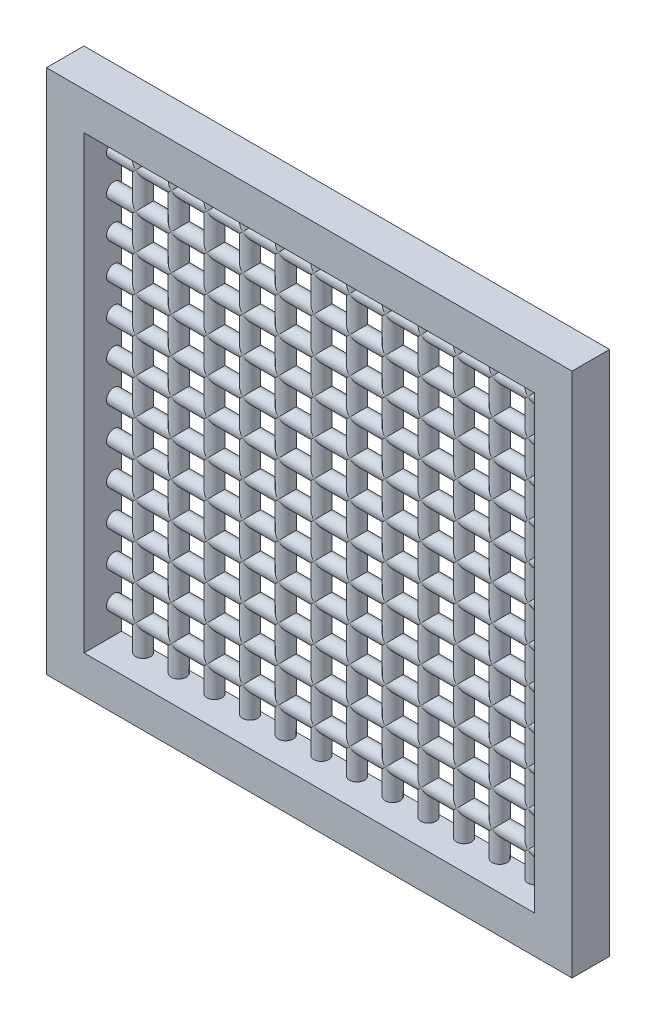
from build123d import *

# Parameters (mm, degrees)
SKETCH1_W                    = 355.6
SKETCH1_H                    = 355.6
SKETCH1_W_2                  = 304.8
SKETCH1_H_2                  = 304.8
BOSS_EXTRUDE1_DEPTH          = 25.4
SKETCH4_R                    = 5.08
LPATTERN1_COUNT              = 12
LPATTERN1_PITCH              = 24.13
CIRPATTERN1_COUNT            = 2
CIRPATTERN1_ANGLE            = 90
CIRPATTERN1_COPY_1_SKETCH_R  = 5.08
CIRPATTERN1_COPY_2_SKETCH_R  = 5.08
CIRPATTERN1_COPY_3_SKETCH_R  = 5.08
CIRPATTERN1_COPY_4_SKETCH_R  = 5.08
CIRPATTERN1_COPY_5_SKETCH_R  = 5.08
CIRPATTERN1_COPY_6_SKETCH_R  = 5.08
CIRPATTERN1_COPY_7_SKETCH_R  = 5.08
CIRPATTERN1_COPY_8_SKETCH_R  = 5.08
CIRPATTERN1_COPY_9_SKETCH_R  = 5.08
CIRPATTERN1_COPY_10_SKETCH_R = 5.08
CIRPATTERN1_COPY_11_SKETCH_R = 5.08


with BuildPart() as part:
    # Sketch1 → Boss-Extrude1 (new body)
    with BuildSketch(Plane.XY):
        Rectangle(SKETCH1_W, SKETCH1_H)
        Rectangle(SKETCH1_W_2, SKETCH1_H_2, mode=Mode.SUBTRACT)
    extrude(amount=BOSS_EXTRUDE1_DEPTH)

    # Sweep1: sweep along a path in Sketch3
    with BuildLine(Plane(origin=(0, 0, 5.08), x_dir=(-1, 0, 0), z_dir=(0, 0, -1))) as sweep1_path:
        Line((-152.4, 132.715), (152.4, 132.715))
    # Sketch4 → Sweep1 (sweep)
    with BuildSketch(Plane(origin=(-152.4, 0, 0), x_dir=(0, 0, -1), z_dir=(1, 0, 0))):
        with Locations((-5.08, 132.715)):
            Circle(SKETCH4_R)
    sweep1 = sweep(path=sweep1_path.line)

    # LPattern1: Sweep1 ×12
    with Locations(*[(0, -i * LPATTERN1_PITCH, 0) for i in range(1, LPATTERN1_COUNT)]):
        add(sweep1)

    # CirPattern1: Sweep1 ×2 about axis
    cirpattern1_axis = Axis((0, 0, 25.4), (0, 0, -1))
    for i in range(1, CIRPATTERN1_COUNT):
        add(sweep1.rotate(cirpattern1_axis, i * CIRPATTERN1_ANGLE / (CIRPATTERN1_COUNT - 1)))

    # CirPattern1 copy 1: sweep along a path in CirPattern1 copy 1 path
    with BuildLine(Plane(origin=(-24.13, 0, 5.08), x_dir=(0, 1, 0), z_dir=(0, 0, -1))) as cirpattern1_copy_1_path:
        Line((-152.4, 132.715), (152.4, 132.715))
    # CirPattern1 copy 1 sketch → CirPattern1 copy 1 (sweep)
    with BuildSketch(Plane(origin=(-24.13, 152.4, 0), x_dir=(0, 0, -1), z_dir=(0, -1, 0))):
        with Locations((-5.08, 132.715)):
            Circle(CIRPATTERN1_COPY_1_SKETCH_R)
    sweep(path=cirpattern1_copy_1_path.line)

    # CirPattern1 copy 2: sweep along a path in CirPattern1 copy 2 path
    with BuildLine(Plane(origin=(-48.26, 0, 5.08), x_dir=(0, 1, 0), z_dir=(0, 0, -1))) as cirpattern1_copy_2_path:
        Line((-152.4, 132.715), (152.4, 132.715))
    # CirPattern1 copy 2 sketch → CirPattern1 copy 2 (sweep)
    with BuildSketch(Plane(origin=(-48.26, 152.4, 0), x_dir=(0, 0, -1), z_dir=(0, -1, 0))):
        with Locations((-5.08, 132.715)):
            Circle(CIRPATTERN1_COPY_2_SKETCH_R)
    sweep(path=cirpattern1_copy_2_path.line)

    # CirPattern1 copy 3: sweep along a path in CirPattern1 copy 3 path
    with BuildLine(Plane(origin=(-72.39, 0, 5.08), x_dir=(0, 1, 0), z_dir=(0, 0, -1))) as cirpattern1_copy_3_path:
        Line((-152.4, 132.715), (152.4, 132.715))
    # CirPattern1 copy 3 sketch → CirPattern1 copy 3 (sweep)
    with BuildSketch(Plane(origin=(-72.39, 152.4, 0), x_dir=(0, 0, -1), z_dir=(0, -1, 0))):
        with Locations((-5.08, 132.715)):
            Circle(CIRPATTERN1_COPY_3_SKETCH_R)
    sweep(path=cirpattern1_copy_3_path.line)

    # CirPattern1 copy 4: sweep along a path in CirPattern1 copy 4 path
    with BuildLine(Plane(origin=(-96.52, 0, 5.08), x_dir=(0, 1, 0), z_dir=(0, 0, -1))) as cirpattern1_copy_4_path:
        Line((-152.4, 132.715), (152.4, 132.715))
    # CirPattern1 copy 4 sketch → CirPattern1 copy 4 (sweep)
    with BuildSketch(Plane(origin=(-96.52, 152.4, 0), x_dir=(0, 0, -1), z_dir=(0, -1, 0))):
        with Locations((-5.08, 132.715)):
            Circle(CIRPATTERN1_COPY_4_SKETCH_R)
    sweep(path=cirpattern1_copy_4_path.line)

    # CirPattern1 copy 5: sweep along a path in CirPattern1 copy 5 path
    with BuildLine(Plane(origin=(-120.65, 0, 5.08), x_dir=(0, 1, 0), z_dir=(0, 0, -1))) as cirpattern1_copy_5_path:
        Line((-152.4, 132.715), (152.4, 132.715))
    # CirPattern1 copy 5 sketch → CirPattern1 copy 5 (sweep)
    with BuildSketch(Plane(origin=(-120.65, 152.4, 0), x_dir=(0, 0, -1), z_dir=(0, -1, 0))):
        with Locations((-5.08, 132.715)):
            Circle(CIRPATTERN1_COPY_5_SKETCH_R)
    sweep(path=cirpattern1_copy_5_path.line)

    # CirPattern1 copy 6: sweep along a path in CirPattern1 copy 6 path
    with BuildLine(Plane(origin=(-144.78, 0, 5.08), x_dir=(0, 1, 0), z_dir=(0, 0, -1))) as cirpattern1_copy_6_path:
        Line((-152.4, 132.715), (152.4, 132.715))
    # CirPattern1 copy 6 sketch → CirPattern1 copy 6 (sweep)
    with BuildSketch(Plane(origin=(-144.78, 152.4, 0), x_dir=(0, 0, -1), z_dir=(0, -1, 0))):
        with Locations((-5.08, 132.715)):
            Circle(CIRPATTERN1_COPY_6_SKETCH_R)
    sweep(path=cirpattern1_copy_6_path.line)

    # CirPattern1 copy 7: sweep along a path in CirPattern1 copy 7 path
    with BuildLine(Plane(origin=(-168.91, 0, 5.08), x_dir=(0, 1, 0), z_dir=(0, 0, -1))) as cirpattern1_copy_7_path:
        Line((-152.4, 132.715), (152.4, 132.715))
    # CirPattern1 copy 7 sketch → CirPattern1 copy 7 (sweep)
    with BuildSketch(Plane(origin=(-168.91, 152.4, 0), x_dir=(0, 0, -1), z_dir=(0, -1, 0))):
        with Locations((-5.08, 132.715)):
            Circle(CIRPATTERN1_COPY_7_SKETCH_R)
    sweep(path=cirpattern1_copy_7_path.line)

    # CirPattern1 copy 8: sweep along a path in CirPattern1 copy 8 path
    with BuildLine(Plane(origin=(-193.04, 0, 5.08), x_dir=(0, 1, 0), z_dir=(0, 0, -1))) as cirpattern1_copy_8_path:
        Line((-152.4, 132.715), (152.4, 132.715))
    # CirPattern1 copy 8 sketch → CirPattern1 copy 8 (sweep)
    with BuildSketch(Plane(origin=(-193.04, 152.4, 0), x_dir=(0, 0, -1), z_dir=(0, -1, 0))):
        with Locations((-5.08, 132.715)):
            Circle(CIRPATTERN1_COPY_8_SKETCH_R)
    sweep(path=cirpattern1_copy_8_path.line)

    # CirPattern1 copy 9: sweep along a path in CirPattern1 copy 9 path
    with BuildLine(Plane(origin=(-217.17, 0, 5.08), x_dir=(0, 1, 0), z_dir=(0, 0, -1))) as cirpattern1_copy_9_path:
        Line((-152.4, 132.715), (152.4, 132.715))
    # CirPattern1 copy 9 sketch → CirPattern1 copy 9 (sweep)
    with BuildSketch(Plane(origin=(-217.17, 152.4, 0), x_dir=(0, 0, -1), z_dir=(0, -1, 0))):
        with Locations((-5.08, 132.715)):
            Circle(CIRPATTERN1_COPY_9_SKETCH_R)
    sweep(path=cirpattern1_copy_9_path.line)

    # CirPattern1 copy 10: sweep along a path in CirPattern1 copy 10 path
    with BuildLine(Plane(origin=(-241.3, 0, 5.08), x_dir=(0, 1, 0), z_dir=(0, 0, -1))) as cirpattern1_copy_10_path:
        Line((-152.4, 132.715), (152.4, 132.715))
    # CirPattern1 copy 10 sketch → CirPattern1 copy 10 (sweep)
    with BuildSketch(Plane(origin=(-241.3, 152.4, 0), x_dir=(0, 0, -1), z_dir=(0, -1, 0))):
        with Locations((-5.08, 132.715)):
            Circle(CIRPATTERN1_COPY_10_SKETCH_R)
    sweep(path=cirpattern1_copy_10_path.line)

    # CirPattern1 copy 11: sweep along a path in CirPattern1 copy 11 path
    with BuildLine(Plane(origin=(-265.43, 0, 5.08), x_dir=(0, 1, 0), z_dir=(0, 0, -1))) as cirpattern1_copy_11_path:
        Line((-152.4, 132.715), (152.4, 132.715))
    # CirPattern1 copy 11 sketch → CirPattern1 copy 11 (sweep)
    with BuildSketch(Plane(origin=(-265.43, 152.4, 0), x_dir=(0, 0, -1), z_dir=(0, -1, 0))):
        with Locations((-5.08, 132.715)):
            Circle(CIRPATTERN1_COPY_11_SKETCH_R)
    sweep(path=cirpattern1_copy_11_path.line)


solid = part.part
